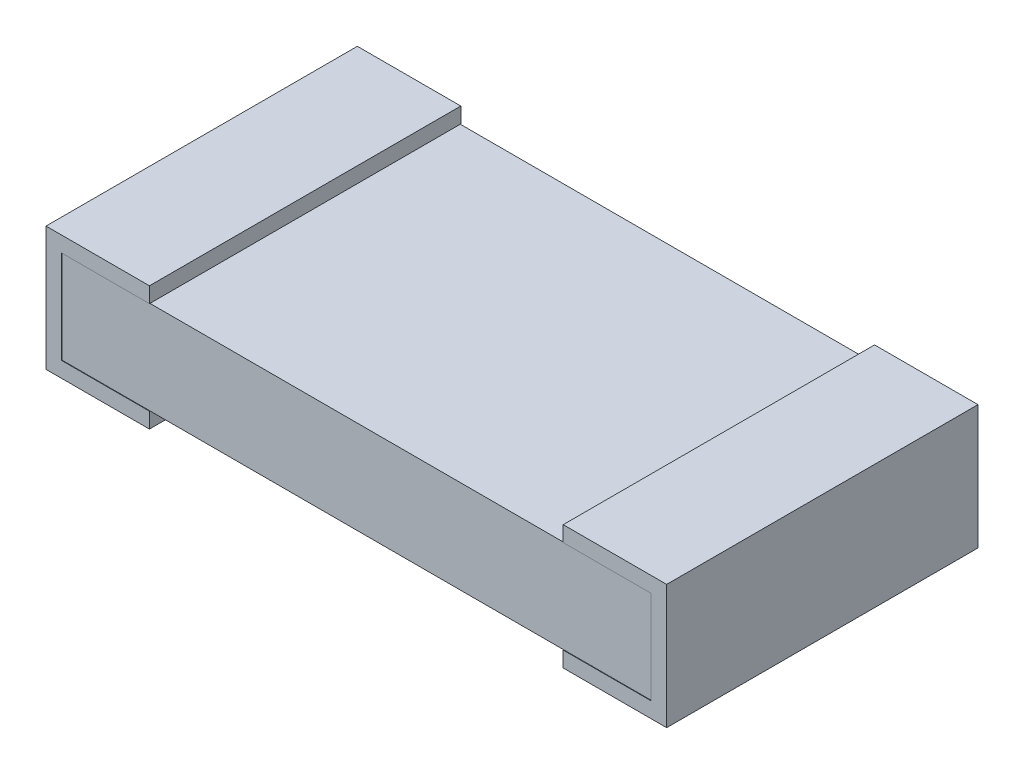
from build123d import *

# Parameters (mm, degrees)
SKETCH1_W           = 2.8956
SKETCH1_H           = 0.4572
BASE_EXTRUDE_DEPTH  = 0.762
BOSS_EXTRUDE1_DEPTH = 1.52908


with BuildPart() as part:
    # Sketch1 → Base-Extrude (new, symmetric)
    with BuildSketch(Plane.XY):
        with Locations((1.524, 0.3048)):
            Rectangle(SKETCH1_W, SKETCH1_H)
    extrude(amount=BASE_EXTRUDE_DEPTH, both=True)

    # Sketch2 → Boss-Extrude1 (add)
    with BuildSketch(Plane(origin=(0, 0, -0.76454), x_dir=(-1, 0, 0), z_dir=(0, 0, -1))):
        Polygon((0, 0), (-0.508, 0), (-0.508, 0.0762), (-0.0762, 0.0762), (-0.0762, 0.5334), (-0.508, 0.5334), (-0.508, 0.6096), (0, 0.6096), align=None)
    boss_extrude1 = extrude(amount=-BOSS_EXTRUDE1_DEPTH)

    # Mirror1: Boss-Extrude1 across plane
    add(boss_extrude1.mirror(Plane(origin=(1.524, 0, 0), x_dir=(0, 0, 1), z_dir=(1, 0, 0))))


solid = part.part
